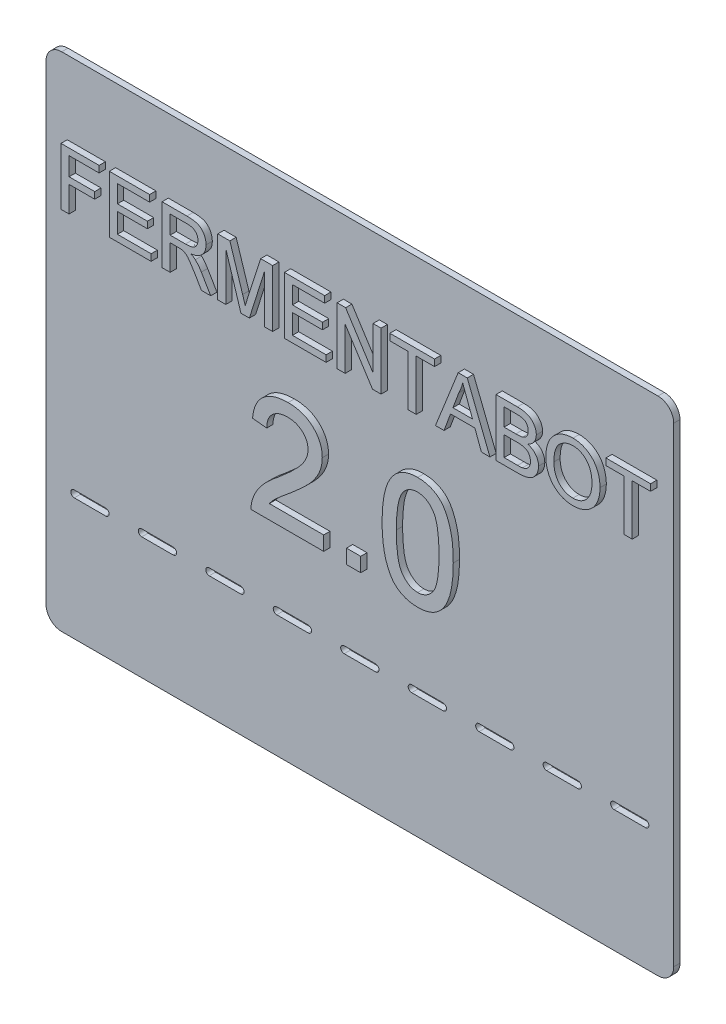
from build123d import *

# Parameters (mm, degrees)
BOSS_EXTRUDE2_DEPTH    = 2.54
BOSS_EXTRUDE2_2_DEPTH  = 2.54
BOSS_EXTRUDE2_3_DEPTH  = 2.54
BOSS_EXTRUDE2_4_DEPTH  = 2.54
BOSS_EXTRUDE2_5_DEPTH  = 2.54
BOSS_EXTRUDE2_6_DEPTH  = 2.54
BOSS_EXTRUDE2_7_DEPTH  = 2.54
BOSS_EXTRUDE2_8_DEPTH  = 2.54
BOSS_EXTRUDE2_9_DEPTH  = 2.54
BOSS_EXTRUDE2_10_DEPTH = 2.54
BOSS_EXTRUDE2_11_DEPTH = 2.54
BOSS_EXTRUDE2_12_DEPTH = 2.54
SKETCH1_W              = 5.76225346
SKETCH1_H              = 5.762253459
BOSS_EXTRUDE2_13_DEPTH = 2.54
BOSS_EXTRUDE2_14_DEPTH = 2.54
SKETCH3_W              = 254
SKETCH3_H              = 203.2
BOSS_EXTRUDE3_DEPTH    = 2.54
CUT_EXTRUDE1_DEPTH     = 163.659188631
LPATTERN1_COUNT        = 5
LPATTERN1_PITCH        = 27.305
LPATTERN2_COUNT        = 5
LPATTERN2_PITCH        = 27.305
FILLET1_R              = 6.35


with BuildPart() as part:
    # Sketch1 → Boss-Extrude2 (new body)
    with BuildSketch(Plane.XY):
        Polygon((-118.389613225, 48.77675534), (-118.389613225, 71.891623504), (-102.979701116, 71.891623504), (-102.979701116, 69.224523332), (-115.129824125, 69.224523332), (-115.129824125, 61.81591174), (-104.757767897, 61.81591174), (-104.757767897, 59.148811568), (-115.129824125, 59.148811568), (-115.129824125, 48.77675534), align=None)
    extrude(amount=BOSS_EXTRUDE2_DEPTH)



with BuildPart() as body_2:
    # Sketch1 → Boss-Extrude2 2 (new body)
    with BuildSketch(Plane.XY):
        Polygon((-98.830878625, 48.77675534), (-98.830878625, 71.891623504), (-82.531933124, 71.891623504), (-82.531933124, 69.224523332), (-95.571089524, 69.224523332), (-95.571089524, 62.112256204), (-83.420966515, 62.112256204), (-83.420966515, 59.445156031), (-95.571089524, 59.445156031), (-95.571089524, 51.443855513), (-81.939244197, 51.443855513), (-81.939244197, 48.77675534), align=None)
    extrude(amount=BOSS_EXTRUDE2_2_DEPTH)


with BuildPart() as body_3:
    # Sketch1 → Boss-Extrude2 3 (new body)
    with BuildSketch(Plane.XY):
        with BuildLine():
            Line((-77.494077242, 48.77675534), (-77.494077242, 71.891623504))
            Line((-77.494077242, 71.891623504), (-67.464669301, 71.891623504))
            add(Edge.make_bspline(
                [(-67.464669301, 71.891623504), (-67.228507454, 71.889773078), (-66.77144384, 71.886191796), (-66.108607228, 71.860840383), (-65.489915698, 71.806189386), (-64.914231686, 71.74709195), (-64.381657473, 71.656385279), (-63.892742502, 71.552346776), (-63.446731913, 71.428539385), (-63.041631769, 71.282313312), (-62.665787167, 71.116880416), (-62.317407611, 70.912762932), (-61.982011411, 70.689093692), (-61.672046291, 70.426315715), (-61.379336889, 70.138598152), (-61.104154499, 69.822031533), (-60.850572976, 69.473868703), (-60.537810536, 68.975575491), (-60.202280205, 68.311953865), (-59.922730736, 67.462661976), (-59.74248224, 66.574271661), (-59.723195136, 65.967159795), (-59.713409424, 65.659129003)],
                knots=[0, 0, 0, 0, 1.242255013, 2.404239178, 3.487702428, 4.508875116, 5.447164253, 6.327763259, 7.137389581, 7.87956647, 8.591787438, 9.293660819, 10.000726923, 10.709654955, 11.427269343, 12.158170644, 12.913245971, 13.690346794, 15.251572448, 16.809945773, 18.381459854, 20, 20, 20, 20], degree=3))
            add(Edge.make_bspline(
                [(-59.713409424, 65.659129003), (-59.717932602, 65.461400706), (-59.726866189, 65.07087376), (-59.795298363, 64.496694617), (-59.919120858, 63.948089534), (-60.077898802, 63.420253928), (-60.295217369, 62.920666384), (-60.546971495, 62.439122675), (-60.858859066, 61.988852091), (-61.20805169, 61.557864649), (-61.608481988, 61.155390948), (-62.063672538, 60.795951251), (-62.56911114, 60.472634525), (-63.127178208, 60.194361202), (-63.731449827, 59.940006174), (-64.389507946, 59.73518725), (-65.098696699, 59.567936893), (-65.590339309, 59.486947815), (-65.844035515, 59.445156031)],
                knots=[0, 0, 0, 0, 0.982609109, 1.940720374, 2.867584677, 3.775009516, 4.675469332, 5.571146231, 6.471115823, 7.392408543, 8.32534739, 9.286126426, 10.269214477, 11.301811357, 12.381622301, 13.524260118, 14.722474812, 16, 16, 16, 16], degree=3))
            add(Edge.make_bspline(
                [(-65.844035515, 59.445156031), (-65.657939737, 59.351144549), (-65.304537153, 59.172613359), (-64.815246897, 58.892678003), (-64.400492484, 58.606653052), (-64.160204236, 58.402079599), (-64.047447205, 58.306081999)],
                knots=[0, 0, 0, 0, 1.172304973, 2.226249348, 3.167654437, 4, 4, 4, 4], degree=3))
            add(Edge.make_bspline(
                [(-64.047447205, 58.306081999), (-63.829086844, 58.092025033), (-63.380559149, 57.652336818), (-62.762468504, 56.903418986), (-62.163208396, 56.06975852), (-61.799112696, 55.467269275), (-61.611866144, 55.157422073)],
                knots=[0, 0, 0, 0, 0.918110279, 1.885863737, 2.912745394, 4, 4, 4, 4], degree=3))
            Line((-61.611866144, 55.157422073), (-57.819583086, 48.77675534))
            Line((-57.819583086, 48.77675534), (-61.556301557, 48.77675534))
            Line((-61.556301557, 48.77675534), (-64.436399313, 53.657178226))
            add(Edge.make_bspline(
                [(-64.436399313, 53.657178226), (-64.539953162, 53.828413729), (-64.740623517, 54.160240017), (-65.030484656, 54.644856338), (-65.314683973, 55.091022876), (-65.578273979, 55.511491315), (-65.831951596, 55.898628258), (-66.073265707, 56.253778542), (-66.295575239, 56.581601275), (-66.570934336, 56.96327225), (-66.89140659, 57.385594725), (-67.265375723, 57.820507125), (-67.621505215, 58.167256989), (-68.060085257, 58.507282115), (-68.60333299, 58.825318465), (-69.065103818, 58.971447432), (-69.289039905, 59.042312776)],
                knots=[0, 0, 0, 0, 1.130940588, 2.191577161, 3.191089816, 4.120344442, 4.99615009, 5.80661983, 6.546979556, 7.234477901, 8.466216387, 9.541989141, 10.473533583, 11.269175393, 12.675684693, 14, 14, 14, 14], degree=3))
            add(Edge.make_bspline(
                [(-69.289039905, 59.042312776), (-69.382995188, 59.059256107), (-69.597497914, 59.097938238), (-69.961723008, 59.1232016), (-70.403026392, 59.150015279), (-70.722846476, 59.149234018), (-70.895782544, 59.148811568)],
                knots=[0, 0, 0, 0, 0.709978628, 1.620902492, 2.713552433, 4, 4, 4, 4], degree=3))
            Line((-70.895782544, 59.148811568), (-74.234288142, 59.148811568))
            Line((-74.234288142, 59.148811568), (-74.234288142, 48.77675534))
            Line((-74.234288142, 48.77675534), (-77.494077242, 48.77675534))
        make_face()
        with BuildLine():
            Line((-74.234288142, 61.81591174), (-68.043467082, 61.81591174))
            add(Edge.make_bspline(
                [(-68.043467082, 61.81591174), (-67.733035863, 61.820768731), (-67.152713818, 61.82984842), (-66.341225244, 61.907379419), (-65.649656422, 62.030579468), (-65.064336025, 62.210281169), (-64.5725745, 62.459766804), (-64.144880159, 62.76381167), (-63.789460778, 63.144659517), (-63.493788567, 63.574365228), (-63.263956492, 64.047234913), (-63.098166595, 64.543915188), (-62.989654224, 65.060231776), (-62.97873234, 65.411629698), (-62.973198524, 65.58967327)],
                knots=[0, 0, 0, 0, 1.546323217, 2.890706218, 4.056530419, 5.041445823, 5.928701482, 6.793137403, 7.641659452, 8.509781392, 9.383301667, 10.251423607, 11.114044887, 12, 12, 12, 12], degree=3))
            add(Edge.make_bspline(
                [(-62.973198524, 65.58967327), (-62.977500835, 65.71942039), (-62.985927797, 65.973556885), (-63.030104722, 66.346558701), (-63.115995154, 66.700996642), (-63.229413257, 67.038744307), (-63.380962859, 67.357327937), (-63.560997603, 67.659216201), (-63.775834632, 67.942735913), (-64.021918087, 68.208750719), (-64.304466613, 68.450798195), (-64.627203456, 68.659632668), (-64.987583209, 68.837096917), (-65.386024754, 68.977944409), (-65.821272929, 69.090599475), (-66.295805504, 69.165545257), (-66.807452342, 69.219775776), (-67.161993929, 69.222911247), (-67.344279363, 69.224523332)],
                knots=[0, 0, 0, 0, 0.965208469, 1.890559848, 2.786986821, 3.67262109, 4.535197034, 5.405224191, 6.282113641, 7.175449223, 8.095446547, 9.040936516, 10.026471658, 11.075712529, 12.17809725, 13.364958037, 14.645208957, 16, 16, 16, 16], degree=3))
            Line((-67.344279363, 69.224523332), (-74.234288142, 69.224523332))
            Line((-74.234288142, 69.224523332), (-74.234288142, 61.81591174))
        make_face(mode=Mode.SUBTRACT)
    extrude(amount=BOSS_EXTRUDE2_3_DEPTH)


with BuildPart() as body_4:
    # Sketch1 → Boss-Extrude2 4 (new body)
    with BuildSketch(Plane.XY):
        with BuildLine():
            Line((-54.971898006, 48.77675534), (-54.971898006, 71.891623504))
            Line((-54.971898006, 71.891623504), (-50.068323209, 71.891623504))
            Line((-50.068323209, 71.891623504), (-44.900816624, 55.671394502))
            add(Edge.make_bspline(
                [(-44.900816624, 55.671394502), (-44.843947994, 55.487647575), (-44.733967375, 55.132291715), (-44.570879165, 54.619125154), (-44.422496235, 54.142251862), (-44.288854041, 53.700153927), (-44.162734176, 53.295026344), (-44.053534245, 52.923544742), (-43.949135558, 52.589837109), (-43.887953263, 52.377754997), (-43.858980619, 52.277324317)],
                knots=[0, 0, 0, 0, 1.300204174, 2.514519184, 3.639827924, 4.676153899, 5.636536826, 6.507959918, 7.293450077, 8, 8, 8, 8], degree=3))
            add(Edge.make_bspline(
                [(-43.858980619, 52.277324317), (-43.826711821, 52.386953186), (-43.758041756, 52.620250431), (-43.646716604, 52.987070356), (-43.528263472, 53.392997879), (-43.386511382, 53.83105577), (-43.238751604, 54.308115779), (-43.083658487, 54.823781726), (-42.904761597, 55.372905304), (-42.785875672, 55.753071997), (-42.724536969, 55.949217437)],
                knots=[0, 0, 0, 0, 0.713638162, 1.518667645, 2.393860736, 3.354087503, 4.393659122, 5.512594909, 6.716633584, 8, 8, 8, 8], degree=3))
            Line((-42.724536969, 55.949217437), (-37.607964589, 71.891623504))
            Line((-37.607964589, 71.891623504), (-32.746063232, 71.891623504))
            Line((-32.746063232, 71.891623504), (-32.746063232, 48.77675534))
            Line((-32.746063232, 48.77675534), (-36.005852332, 48.77675534))
            Line((-36.005852332, 48.77675534), (-36.005852332, 68.335489941))
            Line((-36.005852332, 68.335489941), (-42.173521482, 48.77675534))
            Line((-42.173521482, 48.77675534), (-45.581482814, 48.77675534))
            Line((-45.581482814, 48.77675534), (-51.712108905, 68.335489941))
            Line((-51.712108905, 68.335489941), (-51.712108905, 48.77675534))
            Line((-51.712108905, 48.77675534), (-54.971898006, 48.77675534))
        make_face()
    extrude(amount=BOSS_EXTRUDE2_4_DEPTH)


with BuildPart() as body_5:
    # Sketch1 → Boss-Extrude2 5 (new body)
    with BuildSketch(Plane.XY):
        Polygon((-28.004551814, 48.77675534), (-28.004551814, 71.891623504), (-11.705606314, 71.891623504), (-11.705606314, 69.224523332), (-24.744762714, 69.224523332), (-24.744762714, 62.112256204), (-12.594639705, 62.112256204), (-12.594639705, 59.445156031), (-24.744762714, 59.445156031), (-24.744762714, 51.443855513), (-11.112917387, 51.443855513), (-11.112917387, 48.77675534), align=None)
    extrude(amount=BOSS_EXTRUDE2_5_DEPTH)


with BuildPart() as body_6:
    # Sketch1 → Boss-Extrude2 6 (new body)
    with BuildSketch(Plane.XY):
        Polygon((-6.667750432, 48.77675534), (-6.667750432, 71.891623504), (-3.222746042, 71.891623504), (7.853128287, 54.643449644), (7.853128287, 71.891623504), (11.112917387, 71.891623504), (11.112917387, 48.77675534), (7.667912997, 48.77675534), (-3.407961332, 66.024929201), (-3.407961332, 48.77675534), align=None)
    extrude(amount=BOSS_EXTRUDE2_6_DEPTH)


with BuildPart() as body_7:
    # Sketch1 → Boss-Extrude2 7 (new body)
    with BuildSketch(Plane.XY):
        Polygon((22.077662541, 48.77675534), (22.077662541, 69.224523332), (14.66905095, 69.224523332), (14.66905095, 71.891623504), (32.746063232, 71.891623504), (32.746063232, 69.224523332), (25.337451641, 69.224523332), (25.337451641, 48.77675534), align=None)
    extrude(amount=BOSS_EXTRUDE2_7_DEPTH)


with BuildPart() as body_8:
    # Sketch1 → Boss-Extrude2 8 (new body)
    with BuildSketch(Plane.XY):
        Polygon((33.139645723, 48.77675534), (42.317063332, 71.891623504), (45.993586834, 71.891623504), (55.171004442, 48.77675534), (51.712108905, 48.77675534), (49.082051791, 55.889022468), (39.228598375, 55.889022468), (36.59854126, 48.77675534), align=None)
        with BuildLine():
            Line((40.21023941, 58.55612264), (48.100410755, 58.55612264))
            Line((48.100410755, 58.55612264), (45.854675366, 64.631184145))
            add(Edge.make_bspline(
                [(45.854675366, 64.631184145), (45.768581889, 64.865916243), (45.600252886, 65.324861814), (45.34922363, 65.991670987), (45.119887346, 66.624900346), (44.895004288, 67.215470289), (44.691998334, 67.771959439), (44.504882543, 68.290608963), (44.319826604, 68.767813999), (44.208771932, 69.076137622), (44.155325083, 69.224523332)],
                knots=[0, 0, 0, 0, 1.225184869, 2.395467751, 3.491410812, 4.525364584, 5.492066482, 6.394148129, 7.227157926, 8, 8, 8, 8], degree=3))
            add(Edge.make_bspline(
                [(44.155325083, 69.224523332), (44.066913678, 68.85861724), (43.88972632, 68.125296313), (43.518739133, 67.050882777), (43.094342675, 65.986295239), (42.749682183, 65.300282296), (42.576364737, 64.955310902)],
                knots=[0, 0, 0, 0, 0.9891762, 1.982431084, 2.985436691, 4, 4, 4, 4], degree=3))
            Line((42.576364737, 64.955310902), (40.21023941, 58.55612264))
        make_face(mode=Mode.SUBTRACT)
    extrude(amount=BOSS_EXTRUDE2_8_DEPTH)


with BuildPart() as body_9:
    # Sketch1 → Boss-Extrude2 9 (new body)
    with BuildSketch(Plane.XY):
        with BuildLine():
            Line((57.638998178, 48.77675534), (57.638998178, 71.891623504))
            Line((57.638998178, 71.891623504), (66.293182593, 71.891623504))
            add(Edge.make_bspline(
                [(66.293182593, 71.891623504), (66.507792053, 71.890800211), (66.92655612, 71.889193731), (67.53803825, 71.84901733), (68.117157488, 71.794064346), (68.665160544, 71.723228265), (69.179676214, 71.62044655), (69.660225028, 71.495933372), (70.109307752, 71.352311444), (70.658242948, 71.133528728), (71.290830578, 70.796775623), (71.968392026, 70.294286852), (72.557896811, 69.690978087), (73.042972556, 68.999250424), (73.442622654, 68.260354823), (73.725969894, 67.488367946), (73.907129132, 66.70009783), (73.927683763, 66.166337313), (73.937943679, 65.89990888)],
                knots=[0, 0, 0, 0, 0.939712594, 1.833646414, 2.682508961, 3.487467313, 4.25240329, 4.978730417, 5.660668875, 6.315918528, 7.564895217, 8.787077865, 9.996481721, 11.241996224, 12.475862915, 13.665015424, 14.834484263, 16, 16, 16, 16], degree=3))
            add(Edge.make_bspline(
                [(73.937943679, 65.89990888), (73.927158341, 65.652033359), (73.905691646, 65.15867207), (73.734840772, 64.431920885), (73.465185822, 63.726250009), (73.08388609, 63.050238276), (72.596537237, 62.416253166), (71.992363829, 61.84574513), (71.280047782, 61.337491504), (70.745454612, 61.06657738), (70.469787378, 60.92687835)],
                knots=[0, 0, 0, 0, 0.926741525, 1.844548388, 2.778836836, 3.746021974, 4.738420572, 5.759761325, 6.844803049, 8, 8, 8, 8], degree=3))
            add(Edge.make_bspline(
                [(70.469787378, 60.92687835), (70.640316955, 60.873495279), (70.974184855, 60.768980308), (71.454154644, 60.577732572), (71.904699691, 60.359969653), (72.326800707, 60.115333707), (72.71760561, 59.841559283), (73.076011693, 59.538219583), (73.404503989, 59.210008708), (73.702495614, 58.857126307), (73.964249994, 58.481843252), (74.199010973, 58.092361749), (74.392866377, 57.683991582), (74.551762592, 57.257792983), (74.675725263, 56.816399486), (74.764743954, 56.358113414), (74.815482335, 55.884001517), (74.823103078, 55.561927649), (74.82697707, 55.39820195)],
                knots=[0, 0, 0, 0, 1.127427615, 2.20731145, 3.257257018, 4.283066884, 5.282973838, 6.264540225, 7.242620376, 8.210460609, 9.17525685, 10.12748095, 11.077310519, 12.023587065, 12.994999128, 13.967387486, 14.966724908, 16, 16, 16, 16], degree=3))
            add(Edge.make_bspline(
                [(74.82697707, 55.39820195), (74.818992182, 55.13534263), (74.803165164, 54.614323474), (74.676056564, 53.847470895), (74.461249768, 53.109823346), (74.165586483, 52.413307695), (73.813291777, 51.76927643), (73.4128965, 51.19459239), (72.974611562, 50.695169034), (72.486095307, 50.275064724), (71.950498876, 49.918519104), (71.35269476, 49.618284374), (70.697305071, 49.353506115), (69.97100938, 49.141991467), (69.174138294, 48.973964507), (68.295877544, 48.864797117), (67.334877813, 48.7866479), (66.66533758, 48.780145018), (66.316334504, 48.77675534)],
                knots=[0, 0, 0, 0, 1.028073207, 2.037766189, 3.031549473, 4.027532207, 4.992436545, 5.898794514, 6.762903869, 7.584966804, 8.412380356, 9.273953678, 10.198004568, 11.174406109, 12.229717296, 13.381036288, 14.634844708, 16, 16, 16, 16], degree=3))
            Line((66.316334504, 48.77675534), (57.638998178, 48.77675534))
        make_face()
        with BuildLine():
            Line((60.898787278, 62.112256204), (65.663450608, 62.112256204))
            add(Edge.make_bspline(
                [(65.663450608, 62.112256204), (65.819362256, 62.112873049), (66.118903748, 62.114058149), (66.550985215, 62.13058197), (66.949775698, 62.144679155), (67.313732622, 62.180062), (67.644659059, 62.214717926), (67.941230682, 62.261370203), (68.204900114, 62.313936739), (68.366344952, 62.362696152), (68.441679955, 62.385448757)],
                knots=[0, 0, 0, 0, 1.335841395, 2.566453063, 3.705076039, 4.753984432, 5.69893722, 6.555639608, 7.326018133, 8, 8, 8, 8], degree=3))
            add(Edge.make_bspline(
                [(68.441679955, 62.385448757), (68.618690193, 62.447455457), (68.959928891, 62.5669914), (69.417220665, 62.838469543), (69.806700338, 63.164241989), (70.12732419, 63.55006108), (70.373707733, 63.993862071), (70.556394018, 64.486441607), (70.656418812, 65.034685495), (70.670712373, 65.414873369), (70.678154579, 65.612825181)],
                knots=[0, 0, 0, 0, 1.059015028, 2.041559358, 2.989777133, 3.920090524, 4.862499371, 5.848878527, 6.879979022, 8, 8, 8, 8], degree=3))
            add(Edge.make_bspline(
                [(70.678154579, 65.612825181), (70.672170541, 65.80306968), (70.660508343, 66.17383427), (70.562614617, 66.712248738), (70.39321314, 67.213144532), (70.16379715, 67.676411773), (69.873295551, 68.088554522), (69.526571758, 68.442900813), (69.111221129, 68.710771008), (68.722992703, 68.877868988), (68.373812002, 68.98240454), (68.06183131, 69.044253923), (67.707952152, 69.098749381), (67.31101001, 69.145079606), (66.870854732, 69.18103613), (66.386130121, 69.209601206), (65.857990035, 69.221729243), (65.492129291, 69.223568779), (65.302280793, 69.224523332)],
                knots=[0, 0, 0, 0, 1.216168307, 2.37017178, 3.484610845, 4.588286376, 5.664695412, 6.69777344, 7.738183022, 8.803673002, 9.390844981, 10.0665252, 10.835811589, 11.680682236, 12.621801058, 13.660007223, 14.785756265, 16, 16, 16, 16], degree=3))
            Line((65.302280793, 69.224523332), (60.898787278, 69.224523332))
            Line((60.898787278, 69.224523332), (60.898787278, 62.112256204))
        make_face(mode=Mode.SUBTRACT)
        with BuildLine():
            Line((60.898787278, 51.443855513), (66.367268709, 51.443855513))
            add(Edge.make_bspline(
                [(66.367268709, 51.443855513), (66.584901655, 51.446355807), (66.98475342, 51.450949538), (67.531672516, 51.465360295), (67.973752235, 51.500560384), (68.23190343, 51.538461893), (68.344441927, 51.554984687)],
                knots=[0, 0, 0, 0, 1.317581857, 2.420761387, 3.311546315, 4, 4, 4, 4], degree=3))
            add(Edge.make_bspline(
                [(68.344441927, 51.554984687), (68.505788724, 51.588898149), (68.818197836, 51.654563378), (69.258619727, 51.801121321), (69.662430922, 51.969011255), (70.022583506, 52.18238071), (70.356076158, 52.42827439), (70.645906093, 52.735407364), (70.912853221, 53.084362426), (71.144139405, 53.483701801), (71.331167868, 53.925477546), (71.474110523, 54.402863915), (71.550252193, 54.914187092), (71.561463043, 55.265238221), (71.56718797, 55.444505772)],
                knots=[0, 0, 0, 0, 1.067651492, 2.067249321, 3.003744366, 3.895862395, 4.774133402, 5.679610569, 6.621910665, 7.616993802, 8.661192143, 9.724711987, 10.838102842, 12, 12, 12, 12], degree=3))
            add(Edge.make_bspline(
                [(71.56718797, 55.444505772), (71.560809779, 55.65497662), (71.548371657, 56.065416257), (71.430143042, 56.658522329), (71.234848718, 57.208635585), (70.959931216, 57.70813751), (70.622730549, 58.157396485), (70.214751791, 58.538490645), (69.739045553, 58.840907707), (69.194149797, 59.078246573), (68.557275806, 59.247109088), (67.810840755, 59.361672076), (66.942905181, 59.435596826), (66.32267991, 59.441833154), (65.992207747, 59.445156031)],
                knots=[0, 0, 0, 0, 0.96167883, 1.875371887, 2.752872588, 3.621584364, 4.472914353, 5.312011319, 6.159851575, 7.038572308, 8.019870099, 9.164119506, 10.488969081, 12, 12, 12, 12], degree=3))
            Line((65.992207747, 59.445156031), (60.898787278, 59.445156031))
            Line((60.898787278, 59.445156031), (60.898787278, 51.443855513))
        make_face(mode=Mode.SUBTRACT)
    extrude(amount=BOSS_EXTRUDE2_9_DEPTH)


with BuildPart() as body_10:
    # Sketch1 → Boss-Extrude2 10 (new body)
    with BuildSketch(Plane.XY):
        with BuildLine():
            add(Edge.make_bspline(
                [(77.790421706, 60.028584194), (77.798455545, 60.492017378), (77.814109072, 61.394993434), (77.960368413, 62.709842922), (78.197856042, 63.946944299), (78.537365622, 65.106201185), (78.967694989, 66.189430144), (79.490842542, 67.199083982), (80.122544211, 68.123734144), (80.837159773, 68.972182699), (81.635352532, 69.722273409), (82.485200953, 70.388461427), (83.397316978, 70.944140994), (84.363273352, 71.402949123), (85.38717401, 71.755208719), (86.466144148, 72.001822489), (87.599029815, 72.160912336), (88.373383682, 72.178818429), (88.769058007, 72.187967968)],
                knots=[0, 0, 0, 0, 1.203621547, 2.345195544, 3.432004029, 4.472479546, 5.478447225, 6.455936844, 7.420185704, 8.381829745, 9.332027588, 10.260832629, 11.182364398, 12.100723901, 13.034044877, 13.989196293, 14.972532542, 16, 16, 16, 16], degree=3))
            add(Edge.make_bspline(
                [(88.769058007, 72.187967968), (89.030032414, 72.183410863), (89.548280383, 72.174361278), (90.314463752, 72.105506021), (91.060958902, 71.982611314), (91.787030725, 71.817918626), (92.49465559, 71.601848981), (93.184256079, 71.346785341), (93.84979551, 71.030725575), (94.49570154, 70.676865215), (95.114349726, 70.281057103), (95.695753741, 69.843808684), (96.238520941, 69.36842685), (96.74994216, 68.862725582), (97.212951993, 68.309638167), (97.646678552, 67.726012597), (98.038658451, 67.101500243), (98.39028252, 66.441217928), (98.704670169, 65.755363591), (98.973375126, 65.041094645), (99.204107169, 64.306979247), (99.397249355, 63.548672216), (99.535834085, 62.766432794), (99.646190603, 61.963631575), (99.704274288, 61.137644733), (99.714655468, 60.579675902), (99.719912015, 60.297146364)],
                knots=[0, 0, 0, 0, 1.034375294, 2.054082248, 3.045783978, 4.031219655, 5.002789406, 5.976610191, 6.94273282, 7.920236376, 8.894345378, 9.851183672, 10.800797181, 11.752517031, 12.698794154, 13.65688337, 14.632873302, 15.61821402, 16.620222298, 17.621258913, 18.640965868, 19.669244166, 20.720417492, 21.788124603, 22.880008887, 24, 24, 24, 24], degree=3))
            add(Edge.make_bspline(
                [(99.719912015, 60.297146364), (99.715095873, 60.009957909), (99.705580753, 59.442567595), (99.641197559, 58.604358504), (99.527989524, 57.790212658), (99.377838342, 56.99770242), (99.176640341, 56.228477633), (98.937547435, 55.480332881), (98.648351057, 54.757724265), (98.321735857, 54.058910148), (97.952170896, 53.393501649), (97.544515668, 52.766151618), (97.098481375, 52.182728419), (96.620843226, 51.636074939), (96.100447104, 51.135966365), (95.543700978, 50.677726314), (94.952745533, 50.257033061), (94.325595459, 49.885280296), (93.673505819, 49.559425719), (93.009380439, 49.270334003), (92.332725993, 49.023785083), (91.641229883, 48.823981688), (90.936778441, 48.672995862), (90.221354079, 48.559936083), (89.492611535, 48.494835874), (89.002244908, 48.485243917), (88.755166861, 48.480410877)],
                knots=[0, 0, 0, 0, 1.141429366, 2.255090526, 3.338676798, 4.407031443, 5.458968682, 6.496860253, 7.526652771, 8.550250826, 9.560787671, 10.54935636, 11.521089193, 12.477323897, 13.431786008, 14.386110112, 15.340986122, 16.312041, 17.28047646, 18.236612773, 19.189437236, 20.140779471, 21.09494583, 22.051062463, 23.018000708, 24, 24, 24, 24], degree=3))
            add(Edge.make_bspline(
                [(88.755166861, 48.480410877), (88.489503083, 48.484341405), (87.963289673, 48.492126798), (87.18553208, 48.569838287), (86.427123873, 48.688389871), (85.690269881, 48.859542542), (84.975976984, 49.082823294), (84.283400012, 49.353075251), (83.610103097, 49.66668658), (82.96444074, 50.032637), (82.348610512, 50.439534531), (81.768581262, 50.885356502), (81.224673726, 51.365994269), (80.725615391, 51.8893922), (80.255243331, 52.436576917), (79.832365133, 53.027886937), (79.443170255, 53.649911968), (79.099175611, 54.308648062), (78.78842793, 54.984520079), (78.526616297, 55.677744213), (78.296534612, 56.378104183), (78.11329784, 57.089916714), (77.967280431, 57.811539818), (77.869094305, 58.541772738), (77.798183538, 59.281703033), (77.793022003, 59.778370954), (77.790421706, 60.028584194)],
                knots=[0, 0, 0, 0, 1.072727997, 2.12480551, 3.153819198, 4.171534612, 5.177148798, 6.173931848, 7.17235114, 8.174500385, 9.168706755, 10.151274001, 11.127173509, 12.097141049, 13.070188938, 14.039134204, 15.03036519, 16.031505612, 17.038625933, 18.033164522, 19.022845559, 20.014762458, 21.000193215, 21.994692725, 22.989758729, 24, 24, 24, 24], degree=3))
        make_face()
        with BuildLine():
            add(Edge.make_bspline(
                [(81.050210806, 59.991541136), (81.055206278, 59.65782743), (81.064947097, 59.007109254), (81.176387332, 58.058396758), (81.345480091, 57.163238204), (81.57855661, 56.319120667), (81.891868529, 55.534392345), (82.266473496, 54.801512762), (82.714984546, 54.125353681), (83.22750619, 53.507806588), (83.791221243, 52.953048554), (84.393607986, 52.468496921), (85.034801833, 52.062719204), (85.707694008, 51.727663074), (86.417117582, 51.466121213), (87.160947825, 51.282473108), (87.93973126, 51.167616126), (88.470765523, 51.154296235), (88.741275714, 51.147511049)],
                knots=[0, 0, 0, 0, 1.215430442, 2.370003584, 3.475209778, 4.53279855, 5.55522989, 6.548792651, 7.526809858, 8.505409025, 9.467826767, 10.404123909, 11.316848639, 12.227335424, 13.138360512, 14.065900994, 15.014765094, 16, 16, 16, 16], degree=3))
            add(Edge.make_bspline(
                [(88.741275714, 51.147511049), (89.016371065, 51.154396593), (89.555006987, 51.167878467), (90.34553164, 51.28073041), (91.096618553, 51.472856033), (91.815712341, 51.728618758), (92.489812484, 52.074366362), (93.134684257, 52.479234915), (93.732748373, 52.97397269), (94.298685615, 53.529711872), (94.806293198, 54.16141152), (95.256688067, 54.853510861), (95.622557156, 55.616389625), (95.938435733, 56.433242636), (96.169740233, 57.319508728), (96.340688432, 58.265112836), (96.443705436, 59.273096672), (96.454553658, 59.965058872), (96.460122915, 60.320298276)],
                knots=[0, 0, 0, 0, 0.976878588, 1.912725521, 2.8289017, 3.727303729, 4.617335839, 5.514666588, 6.426584173, 7.368641557, 8.327632997, 9.299405846, 10.294892156, 11.327373912, 12.405931897, 13.542618837, 14.738430195, 16, 16, 16, 16], degree=3))
            add(Edge.make_bspline(
                [(96.460122915, 60.320298276), (96.458154742, 60.548836185), (96.454293898, 60.99714486), (96.403163381, 61.657956977), (96.337211575, 62.298214052), (96.236798926, 62.917089927), (96.098417555, 63.512021695), (95.945114496, 64.087538583), (95.753414381, 64.638681104), (95.535903884, 65.167610629), (95.292513322, 65.671611732), (95.018001138, 66.146435485), (94.715557727, 66.590235878), (94.393343365, 67.011426916), (94.033515643, 67.393706781), (93.653400478, 67.753223153), (93.244363569, 68.082548344), (92.810486953, 68.381768379), (92.357925733, 68.651113567), (91.88761286, 68.881638102), (91.407041089, 69.084124942), (90.908166326, 69.239339604), (90.397877073, 69.364522507), (89.874110467, 69.45961058), (89.334922425, 69.50885161), (88.971337347, 69.516833637), (88.787579536, 69.520867795)],
                knots=[0, 0, 0, 0, 1.220438779, 2.394059227, 3.538503547, 4.658058814, 5.74010225, 6.800155734, 7.837851593, 8.854470756, 9.853724944, 10.825214244, 11.781044712, 12.72106398, 13.654479919, 14.581868691, 15.514082315, 16.456304431, 17.39516604, 18.324312202, 19.252140633, 20.177768678, 21.111585046, 22.057694709, 23.018348693, 24, 24, 24, 24], degree=3))
            add(Edge.make_bspline(
                [(88.787579536, 69.520867795), (88.527862938, 69.515709926), (88.015413151, 69.505532875), (87.26102606, 69.392399157), (86.53371511, 69.223361924), (85.832351592, 68.987038864), (85.162934161, 68.674109994), (84.521994622, 68.29034556), (83.903843698, 67.846194863), (83.318228748, 67.33083627), (82.772307522, 66.738815052), (82.310785894, 66.040840177), (81.921802856, 65.253573771), (81.597009186, 64.379011372), (81.349363577, 63.410380072), (81.178209485, 62.351848346), (81.070146283, 61.202300763), (81.057025849, 60.405445379), (81.050210806, 59.991541136)],
                knots=[0, 0, 0, 0, 0.895090134, 1.766112571, 2.624765742, 3.468151641, 4.313618154, 5.168136083, 6.041303099, 6.935189387, 7.854749729, 8.809996334, 9.809869957, 10.877771942, 12.021723904, 13.25217762, 14.572720513, 16, 16, 16, 16], degree=3))
        make_face(mode=Mode.SUBTRACT)
    extrude(amount=BOSS_EXTRUDE2_10_DEPTH)


with BuildPart() as body_11:
    # Sketch1 → Boss-Extrude2 11 (new body)
    with BuildSketch(Plane.XY):
        Polygon((109.499279316, 48.77675534), (109.499279316, 69.224523332), (102.090667725, 69.224523332), (102.090667725, 71.891623504), (120.167680007, 71.891623504), (120.167680007, 69.224523332), (112.759068416, 69.224523332), (112.759068416, 48.77675534), align=None)
    extrude(amount=BOSS_EXTRUDE2_11_DEPTH)


with BuildPart() as body_12:
    # Sketch1 → Boss-Extrude2 12 (new body)
    with BuildSketch(Plane.XY):
        with BuildLine():
            Line((-12.100732265, -12.183170556), (-12.100732265, -17.945424015))
            Line((-12.100732265, -17.945424015), (-41.48822491, -17.945424015))
            add(Edge.make_bspline(
                [(-41.48822491, -17.945424015), (-41.488826549, -17.602957093), (-41.490027811, -16.919171118), (-41.374320209, -15.907895038), (-41.193098939, -14.910034385), (-40.988192113, -14.270146034), (-40.884989001, -13.947860678)],
                knots=[0, 0, 0, 0, 1.01057331, 2.01775941, 3.001627217, 4, 4, 4, 4], degree=3))
            add(Edge.make_bspline(
                [(-40.884989001, -13.947860678), (-40.694303985, -13.421284856), (-40.306037886, -12.349089757), (-39.519406705, -10.802061961), (-38.594142542, -9.264390284), (-37.693267637, -8.012508441), (-36.868260758, -7.012342369), (-36.176384953, -6.229828169), (-35.40965973, -5.428832671), (-34.568699113, -4.60950219), (-33.661596846, -3.766530255), (-32.687115191, -2.897105586), (-31.633747051, -2.017430864), (-30.898385846, -1.434345857), (-30.521936294, -1.135850251)],
                knots=[0, 0, 0, 0, 1.204657718, 2.452881516, 3.728232997, 5.065887527, 5.768225529, 6.518857853, 7.313994055, 8.154655305, 9.046094665, 9.979688118, 10.965752482, 12, 12, 12, 12], degree=3))
            add(Edge.make_bspline(
                [(-30.521936294, -1.135850251), (-29.943616797, -0.649088118), (-28.830025921, 0.288203244), (-27.257461099, 1.679056757), (-25.821179107, 2.970543025), (-24.544051105, 4.185297984), (-23.415631527, 5.311539298), (-22.433270823, 6.346715319), (-21.588516459, 7.287595473), (-20.891681229, 8.168235635), (-20.303739964, 8.999804899), (-19.805511671, 9.810949364), (-19.390304493, 10.615837946), (-19.04449247, 11.411923758), (-18.770984543, 12.202611218), (-18.584549983, 12.990203958), (-18.458116515, 13.766887146), (-18.445466744, 14.283700757), (-18.439211071, 14.539279864)],
                knots=[0, 0, 0, 0, 1.782554561, 3.432421876, 4.950675607, 6.337395053, 7.588547463, 8.709982106, 9.702713005, 10.569305638, 11.356701089, 12.103210377, 12.812277205, 13.490692607, 14.148717897, 14.782152033, 15.397739362, 16, 16, 16, 16], degree=3))
            add(Edge.make_bspline(
                [(-18.439211071, 14.539279864), (-18.445467497, 14.791876934), (-18.457742264, 15.287458649), (-18.574204649, 16.012739389), (-18.736329627, 16.711202071), (-18.998436373, 17.370272839), (-19.310422306, 18.009469336), (-19.710619568, 18.608593769), (-20.173565532, 19.182577848), (-20.703599479, 19.716288318), (-21.282520673, 20.216993946), (-21.929382608, 20.633201958), (-22.601699568, 21.007913182), (-23.322665924, 21.309202499), (-24.091110143, 21.53044462), (-24.901438311, 21.691009422), (-25.753521845, 21.792816111), (-26.335008959, 21.80691425), (-26.632415209, 21.814124857)],
                knots=[0, 0, 0, 0, 0.988194508, 1.938783882, 2.870742509, 3.789494954, 4.709148727, 5.651055405, 6.603531303, 7.592354411, 8.592907906, 9.593461401, 10.59787167, 11.603930315, 12.645063138, 13.723588815, 14.835711238, 16, 16, 16, 16], degree=3))
            add(Edge.make_bspline(
                [(-26.632415209, 21.814124857), (-26.944832206, 21.806949961), (-27.556255228, 21.792908163), (-28.449991947, 21.690695451), (-29.298440041, 21.534528243), (-30.099574399, 21.295761946), (-30.852419938, 20.994975045), (-31.553910485, 20.616364443), (-32.215279822, 20.188981553), (-32.815698885, 19.682992452), (-33.35864997, 19.121953752), (-33.840664133, 18.511152315), (-34.235602316, 17.838800951), (-34.561758546, 17.119683153), (-34.824015461, 16.351538288), (-35.014405062, 15.528494043), (-35.118206749, 14.652926842), (-35.139080397, 14.053338666), (-35.149746104, 13.746970013)],
                knots=[0, 0, 0, 0, 1.131143733, 2.213731411, 3.253917892, 4.251203413, 5.236093891, 6.184197493, 7.13373276, 8.082770301, 9.020476205, 9.957489029, 10.893177274, 11.836722509, 12.812818608, 13.827831385, 14.890097571, 16, 16, 16, 16], degree=3))
            Line((-35.149746104, 13.746970013), (-40.911999564, 14.323195359))
            add(Edge.make_bspline(
                [(-40.911999564, 14.323195359), (-40.853043525, 14.825389828), (-40.738349626, 15.802365941), (-40.452662771, 17.217351282), (-40.05158428, 18.53369325), (-39.571660015, 19.769744419), (-38.970029731, 20.904463475), (-38.289938481, 21.961320808), (-37.487802228, 22.906797336), (-36.601654485, 23.770695833), (-35.621786533, 24.532017724), (-34.557402715, 25.197138094), (-33.408989915, 25.753470218), (-32.182944387, 26.214090023), (-30.876451433, 26.563573861), (-29.491359309, 26.814186749), (-28.02544054, 26.968667398), (-27.01994901, 26.989508031), (-26.506365915, 27.00015297)],
                knots=[0, 0, 0, 0, 1.130804643, 2.199883102, 3.223565206, 4.205909148, 5.160801384, 6.091796021, 7.01151579, 7.927798993, 8.855738875, 9.7815393, 10.730299821, 11.705391175, 12.706931101, 13.751121791, 14.851322166, 16, 16, 16, 16], degree=3))
            add(Edge.make_bspline(
                [(-26.506365915, 27.00015297), (-25.986635514, 26.991253177), (-24.974197632, 26.973916326), (-23.498912906, 26.796525536), (-22.106940993, 26.520240997), (-20.793178963, 26.135184937), (-19.565388704, 25.630261619), (-18.422625764, 25.013359337), (-17.359621098, 24.290495798), (-16.394135337, 23.452993494), (-15.523531586, 22.538719437), (-14.760575772, 21.562991925), (-14.122707986, 20.529979285), (-13.579603167, 19.453762195), (-13.176762279, 18.311600887), (-12.893477143, 17.119023264), (-12.700976678, 15.875010233), (-12.685070407, 15.026217296), (-12.676957611, 14.59330099)],
                knots=[0, 0, 0, 0, 1.195390245, 2.328627238, 3.413424916, 4.457841177, 5.473507151, 6.462241215, 7.441013641, 8.425227782, 9.397253344, 10.342087291, 11.269524934, 12.186751184, 13.110685745, 14.048630397, 15.004728144, 16, 16, 16, 16], degree=3))
            add(Edge.make_bspline(
                [(-12.676957611, 14.59330099), (-12.689345719, 14.148528538), (-12.714149273, 13.258002096), (-12.907744316, 11.926927696), (-13.238987596, 10.610298415), (-13.678127777, 9.292090085), (-14.278084663, 7.967070795), (-15.036028312, 6.616961867), (-15.976340227, 5.236776116), (-16.880656652, 4.063464888), (-17.722428474, 3.079934204), (-18.468579641, 2.270430986), (-19.331833358, 1.410387949), (-20.279805746, 0.470019814), (-21.351159678, -0.517297786), (-22.515112662, -1.581130651), (-23.79714418, -2.693482744), (-24.687123913, -3.453388299), (-25.146834239, -3.845910081)],
                knots=[0, 0, 0, 0, 0.927118007, 1.856282007, 2.79721255, 3.754929441, 4.749232485, 5.824981375, 6.979078785, 8.228161913, 8.911614355, 9.677694854, 10.522803217, 11.452009355, 12.461436787, 13.560019032, 14.739651695, 16, 16, 16, 16], degree=3))
            add(Edge.make_bspline(
                [(-25.146834239, -3.845910081), (-25.540506696, -4.166401427), (-26.291179475, -4.777529091), (-27.359156929, -5.663497238), (-28.315739895, -6.475906027), (-29.183297914, -7.188256218), (-29.930235094, -7.8350033), (-30.582861241, -8.387822574), (-31.117466093, -8.874509591), (-31.931574639, -9.613796989), (-32.962712571, -10.667576453), (-33.722499103, -11.69150452), (-34.087330623, -12.183170556)],
                knots=[0, 0, 0, 0, 1.241996727, 2.368296581, 3.394949853, 4.3125351, 5.114548721, 5.812230366, 6.404953749, 6.883082049, 8.503329734, 10, 10, 10, 10], degree=3))
            Line((-34.087330623, -12.183170556), (-12.100732265, -12.183170556))
        make_face()
    extrude(amount=BOSS_EXTRUDE2_12_DEPTH)


with BuildPart() as body_13:
    # Sketch1 → Boss-Extrude2 13 (new body)
    with BuildSketch(Plane.XY):
        with Locations((0, -15.064297286)):
            Rectangle(SKETCH1_W, SKETCH1_H)
    extrude(amount=BOSS_EXTRUDE2_13_DEPTH)


with BuildPart() as body_14:
    # Sketch1 → Boss-Extrude2 14 (new body)
    with BuildSketch(Plane.XY):
        with BuildLine():
            add(Edge.make_bspline(
                [(11.524506919, 4.221244763), (11.530312391, 4.863558314), (11.541682865, 6.121580075), (11.612210223, 7.962291908), (11.735345274, 9.710339718), (11.919152006, 11.364205408), (12.136813615, 12.927622077), (12.419775078, 14.398358569), (12.738147861, 15.779714717), (13.120138067, 17.070250683), (13.539820253, 18.281062725), (14.015963081, 19.410208428), (14.551688354, 20.456490632), (15.120668504, 21.43075987), (15.752855813, 22.317862245), (16.410092721, 23.142693483), (17.140143284, 23.875003803), (17.912650432, 24.533635615), (18.738989535, 25.114839807), (19.614788437, 25.616348921), (20.536677304, 26.059145308), (21.522226316, 26.392482313), (22.550975666, 26.664222635), (23.630844134, 26.864118112), (24.763021716, 26.981963241), (25.536705947, 26.994021231), (25.930140569, 27.00015297)],
                knots=[0, 0, 0, 0, 1.514747001, 2.966751498, 4.343369068, 5.64627492, 6.890416844, 8.064737671, 9.177176366, 10.232018008, 11.237056675, 12.19799043, 13.119080079, 14.007588942, 14.855863561, 15.685992447, 16.491747269, 17.290132607, 18.077525251, 18.870243746, 19.668095604, 20.485086593, 21.319398728, 22.175900658, 23.072407314, 24, 24, 24, 24], degree=3))
            add(Edge.make_bspline(
                [(25.930140569, 27.00015297), (26.50736033, 26.983183118), (27.641331705, 26.949845162), (29.296935769, 26.677946843), (30.857235892, 26.212822864), (32.32121836, 25.585350549), (33.663856619, 24.788339943), (34.862889175, 23.819452123), (35.905382524, 22.688860219), (36.779959466, 21.383167089), (37.54442701, 19.938392468), (38.223563194, 18.348051675), (38.837482579, 16.613926866), (39.273133139, 15.061643076), (39.583882326, 13.721656629), (39.789573598, 12.616473713), (39.96033859, 11.423975125), (40.091167653, 10.14704584), (40.198509811, 8.787118048), (40.281405241, 7.343345031), (40.323483159, 5.812118324), (40.331600392, 4.761477211), (40.335774218, 4.221244763)],
                knots=[0, 0, 0, 0, 1.134486744, 2.228744715, 3.287356444, 4.328707449, 5.352829806, 6.347195599, 7.349461267, 8.364207941, 9.428085653, 10.559314403, 11.761222316, 13.04268526, 13.726896727, 14.465273606, 15.252205015, 16.094778733, 16.988606776, 17.934225168, 18.937792761, 20, 20, 20, 20], degree=3))
            add(Edge.make_bspline(
                [(40.335774218, 4.221244763), (40.32986, 3.581948252), (40.318305412, 2.33295668), (40.249667868, 0.507004254), (40.119113067, -1.227855386), (39.958462999, -2.875596301), (39.715433096, -4.431819796), (39.453555209, -5.903137854), (39.129676948, -7.282869396), (38.751787057, -8.571619121), (38.32619723, -9.776201475), (37.859472129, -10.905720021), (37.342529264, -11.959402945), (36.759982465, -12.926973152), (36.138485886, -13.821273517), (35.473487725, -14.645658762), (34.750889243, -15.388263599), (33.971420601, -16.044919871), (33.150883438, -16.636430886), (32.272955308, -17.142891409), (31.341478766, -17.562485156), (30.362677366, -17.921216963), (29.326619755, -18.184074591), (28.241476187, -18.385287998), (27.103248419, -18.503777023), (26.326571644, -18.51560972), (25.930140569, -18.521649361)],
                knots=[0, 0, 0, 0, 1.508974709, 2.94807912, 4.311757619, 5.615040294, 6.854280449, 8.028314546, 9.141715822, 10.197470207, 11.196696834, 12.155719058, 13.080757287, 13.963948316, 14.818758719, 15.649605906, 16.461113142, 17.260189315, 18.052359509, 18.845763934, 19.647754795, 20.461145776, 21.303032214, 22.167241874, 23.064524267, 24, 24, 24, 24], degree=3))
            add(Edge.make_bspline(
                [(25.930140569, -18.521649361), (25.410373464, -18.506822977), (24.396970668, -18.477915609), (22.916970608, -18.281507846), (21.52791161, -17.935820963), (20.218077756, -17.472206109), (19.002191936, -16.852094543), (17.87444878, -16.097607735), (16.812187103, -15.226299616), (16.200684701, -14.53885751), (15.891214619, -14.190955745)],
                knots=[0, 0, 0, 0, 1.10322584, 2.150986741, 3.161425019, 4.136713905, 5.093944212, 6.049774532, 7.013026876, 8, 8, 8, 8], degree=3))
            add(Edge.make_bspline(
                [(15.891214619, -14.190955745), (15.535007437, -13.677121659), (14.800492978, -12.617573777), (13.94080749, -10.810946352), (13.173952815, -8.822103213), (12.572112493, -6.612023493), (12.100721495, -4.198296928), (11.760259503, -1.576187274), (11.567591533, 1.253172633), (11.539192661, 3.209553222), (11.524506919, 4.221244763)],
                knots=[0, 0, 0, 0, 0.779365345, 1.607084704, 2.489375761, 3.438383567, 4.461919411, 5.557722155, 6.737039282, 8, 8, 8, 8], degree=3))
        make_face()
        with BuildLine():
            add(Edge.make_bspline(
                [(17.286760379, 4.239251805), (17.292481839, 3.374784882), (17.303433978, 1.72000398), (17.417857245, -0.644136037), (17.61483219, -2.776913039), (17.875245933, -4.675374057), (18.219097511, -6.342087135), (18.650843835, -7.772804975), (19.137524632, -8.984699434), (19.739782896, -9.962750014), (20.399189176, -10.760003913), (21.079981094, -11.445668049), (21.798175332, -12.028466865), (22.549085759, -12.514402224), (23.344363291, -12.882320551), (24.175311699, -13.148988574), (25.042111792, -13.302451927), (25.632442043, -13.324501723), (25.930140569, -13.335621248)],
                knots=[0, 0, 0, 0, 1.89448813, 3.626469325, 5.185477471, 6.587276848, 7.82441448, 8.910550357, 9.859733512, 10.6775885, 11.416198291, 12.123144072, 12.791880183, 13.439617036, 14.078171869, 14.70637855, 15.347637704, 16, 16, 16, 16], degree=3))
            add(Edge.make_bspline(
                [(25.930140569, -13.335621248), (26.227764547, -13.32425876), (26.817946972, -13.301727172), (27.686749886, -13.151647835), (28.514465266, -12.871251926), (29.30855704, -12.504633083), (30.064925309, -12.029773653), (30.779592282, -11.444773474), (31.463970475, -10.759516462), (32.120414718, -9.952995939), (32.718084613, -8.970423506), (33.213894945, -7.759516256), (33.638912743, -6.326292803), (33.984651101, -4.660428908), (34.24613909, -2.764969499), (34.441923102, -0.638107854), (34.557112118, 1.722990286), (34.56788351, 3.374780982), (34.573520758, 4.239251805)],
                knots=[0, 0, 0, 0, 0.652509534, 1.29391342, 1.924290653, 2.562989607, 3.207355802, 3.876242846, 4.583348185, 5.32723334, 6.150888545, 7.094226006, 8.186903555, 9.424320409, 10.81992305, 12.379283064, 14.105084285, 16, 16, 16, 16], degree=3))
            add(Edge.make_bspline(
                [(34.573520758, 4.239251805), (34.568064005, 5.085735787), (34.557609072, 6.707567063), (34.439449174, 9.026161865), (34.254281995, 11.123141075), (34.001002709, 13.000437915), (33.664394586, 14.656014321), (33.25613485, 16.093394791), (32.769632329, 17.309513878), (32.191182569, 18.31658752), (31.547252245, 19.142661115), (30.874605979, 19.857699689), (30.156427544, 20.465816701), (29.379992981, 20.953657139), (28.570328236, 21.347228659), (27.708829271, 21.618094602), (26.803963939, 21.784506165), (26.182966601, 21.804139156), (25.867115921, 21.814124857)],
                knots=[0, 0, 0, 0, 1.850066095, 3.544656626, 5.0727657, 6.45041401, 7.682899467, 8.762389858, 9.712573485, 10.538438529, 11.291566246, 11.996865408, 12.681389046, 13.341983376, 13.996294293, 14.643563182, 15.31009126, 16, 16, 16, 16], degree=3))
            add(Edge.make_bspline(
                [(25.867115921, 21.814124857), (25.569436093, 21.806311936), (24.982449617, 21.790905858), (24.123024543, 21.643855), (23.308557497, 21.397953189), (22.529717319, 21.064855309), (21.805947338, 20.616571357), (21.108544637, 20.093167933), (20.470172861, 19.45545928), (20.08549563, 18.97871826), (19.888777957, 18.734920664)],
                knots=[0, 0, 0, 0, 1.021318143, 2.013908504, 2.982026795, 3.937174072, 4.91255697, 5.897578595, 6.924855925, 8, 8, 8, 8], degree=3))
            add(Edge.make_bspline(
                [(19.888777957, 18.734920664), (19.674612425, 18.376857508), (19.222339913, 17.620703511), (18.71627327, 16.306476709), (18.269234004, 14.804565632), (17.901172474, 13.091862286), (17.634905777, 11.171304646), (17.424698516, 9.045123077), (17.315503669, 6.710349176), (17.296605821, 5.085677049), (17.286760379, 4.239251805)],
                knots=[0, 0, 0, 0, 0.671104906, 1.417232262, 2.260109084, 3.195198885, 4.23592645, 5.382417421, 6.636286093, 8, 8, 8, 8], degree=3))
        make_face(mode=Mode.SUBTRACT)
    extrude(amount=BOSS_EXTRUDE2_14_DEPTH)


with BuildPart() as part_1:
    add(part.part)

    add(body_2.part)  # Boss-Extrude3 merges body 2

    add(body_3.part)  # Boss-Extrude3 merges body 3

    add(body_4.part)  # Boss-Extrude3 merges body 4

    add(body_5.part)  # Boss-Extrude3 merges body 5

    add(body_6.part)  # Boss-Extrude3 merges body 6

    add(body_7.part)  # Boss-Extrude3 merges body 7

    add(body_8.part)  # Boss-Extrude3 merges body 8

    add(body_9.part)  # Boss-Extrude3 merges body 9

    add(body_10.part)  # Boss-Extrude3 merges body 10

    add(body_11.part)  # Boss-Extrude3 merges body 11

    add(body_12.part)  # Boss-Extrude3 merges body 12

    add(body_13.part)  # Boss-Extrude3 merges body 13
    # Sketch3 → Boss-Extrude3 (add)
    with BuildSketch(Plane(origin=(0, 0, 0), x_dir=(-1, 0, 0), z_dir=(0, 0, -1))):
        Rectangle(SKETCH3_W, SKETCH3_H)
    extrude(amount=BOSS_EXTRUDE3_DEPTH)

    # Sketch4 → Cut-Extrude1 (cut, through all)
    with BuildSketch(Plane.XY):
        with BuildLine():
            Line((-6.35, -52.197), (6.35, -52.197))
            ThreePointArc((6.35, -52.197), (7.747, -50.8), (6.35, -49.403))
            Line((6.35, -49.403), (-6.35, -49.403))
            ThreePointArc((-6.35, -49.403), (-7.747, -50.8), (-6.35, -52.197))
        make_face()
    cut_extrude1 = extrude(amount=-CUT_EXTRUDE1_DEPTH, mode=Mode.SUBTRACT)

    # LPattern1: Cut-Extrude1 ×5
    with Locations(*[(i * LPATTERN1_PITCH, 0, 0) for i in range(1, LPATTERN1_COUNT)]):
        add(cut_extrude1, mode=Mode.SUBTRACT)

    # LPattern2: Cut-Extrude1 ×5
    with Locations(*[(-i * LPATTERN2_PITCH, 0, 0) for i in range(1, LPATTERN2_COUNT)]):
        add(cut_extrude1, mode=Mode.SUBTRACT)

    # Fillet1
    fillet1_edges = [part_1.edges().sort_by_distance(p)[0] for p in [
        (-127, -101.6, -1.27),
        (-127, 101.6, -1.27),
        (127, 101.6, -1.27),
        (127, -101.6, -1.27),
    ]]
    fillet(fillet1_edges, radius=FILLET1_R)


solid = Compound([body_14.part, part_1.part])
